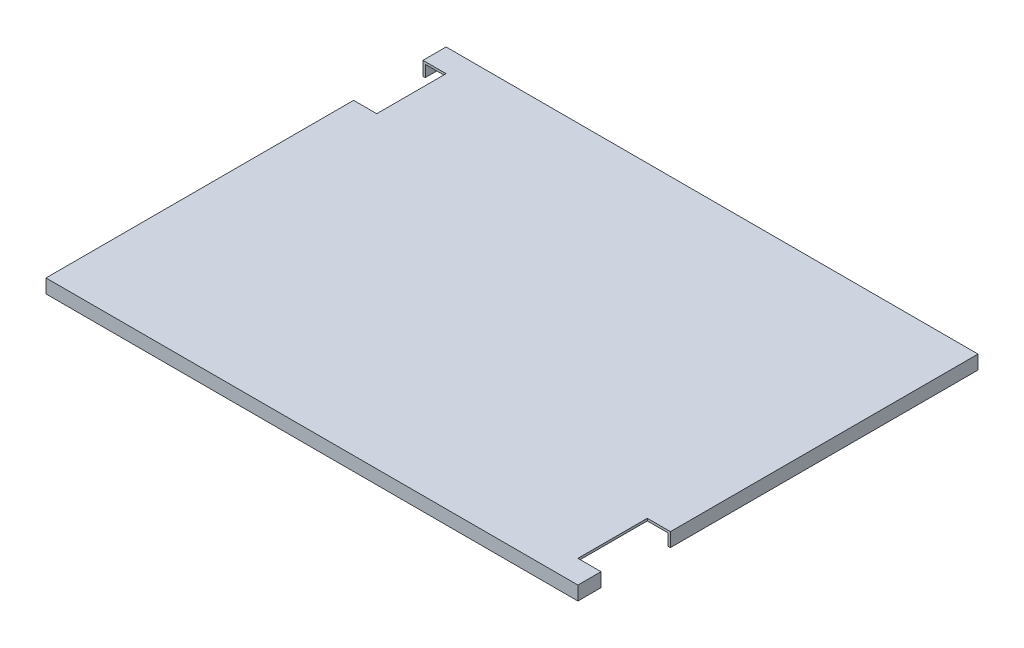
from build123d import *

# Parameters (mm, degrees)
SKETCH1_W           = 230
SKETCH1_H           = 173
BOSS_EXTRUDE1_DEPTH = 6
SKETCH2_W           = 228
SKETCH2_H           = 171
CUT_EXTRUDE1_DEPTH  = 5
SKETCH3_W           = 10
SKETCH3_H           = 30
CUT_EXTRUDE2_DEPTH  = 145.025171411


with BuildPart() as part:
    # Sketch1 → Boss-Extrude1 (new body)
    with BuildSketch(Plane(origin=(0, 0, 0), x_dir=(1, 0, 0), z_dir=(0, 1, 0))):
        Rectangle(SKETCH1_W, SKETCH1_H)
    extrude(amount=BOSS_EXTRUDE1_DEPTH)

    # Sketch2 → Cut-Extrude1 (cut)
    with BuildSketch(Plane(origin=(0, 0, 0), x_dir=(1, 0, 0), z_dir=(0, 1, 0))):
        Rectangle(SKETCH2_W, SKETCH2_H)
    extrude(amount=CUT_EXTRUDE1_DEPTH, mode=Mode.SUBTRACT)

    # Sketch3 → Cut-Extrude2 (cut, through all)
    with BuildSketch(Plane(origin=(0, 6, 0), x_dir=(1, 0, 0), z_dir=(0, 1, 0))):
        with Locations((110, -61.5)):
            Rectangle(SKETCH3_W, SKETCH3_H)
        with Locations((-110, 61.5)):
            Rectangle(SKETCH3_W, SKETCH3_H)
    extrude(amount=-CUT_EXTRUDE2_DEPTH, mode=Mode.SUBTRACT)


solid = part.part
